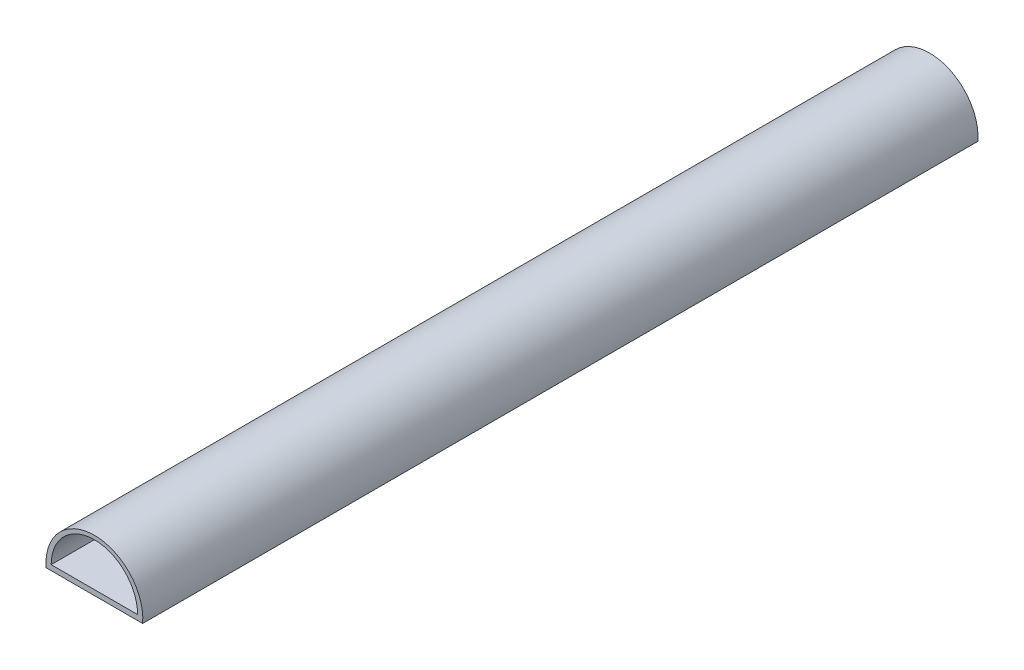
from build123d import *

# Parameters (mm, degrees)
BOSS_EXTRUDE2_DEPTH = 254


with BuildPart() as part:
    # Sketch1 → Boss-Extrude2 (new body)
    with BuildSketch(Plane.XY):
        with BuildLine():
            Line((-23.111377793, -10.048425127), (6.257372207, -10.048425127))
            ThreePointArc((6.257372207, -10.048425127), (-8.427002793, 5.85418124), (-23.111377793, -10.048425127))
        make_face()
        with BuildLine():
            Line((-8.427002793, -8.460925127), (-21.571502793, -8.460925127))
            ThreePointArc((-21.571502793, -8.460925127), (-8.427002793, 4.683574873), (4.717497207, -8.460925127))
            Line((4.717497207, -8.460925127), (-8.427002793, -8.460925127))
        make_face(mode=Mode.SUBTRACT)
    extrude(amount=BOSS_EXTRUDE2_DEPTH)


solid = part.part
